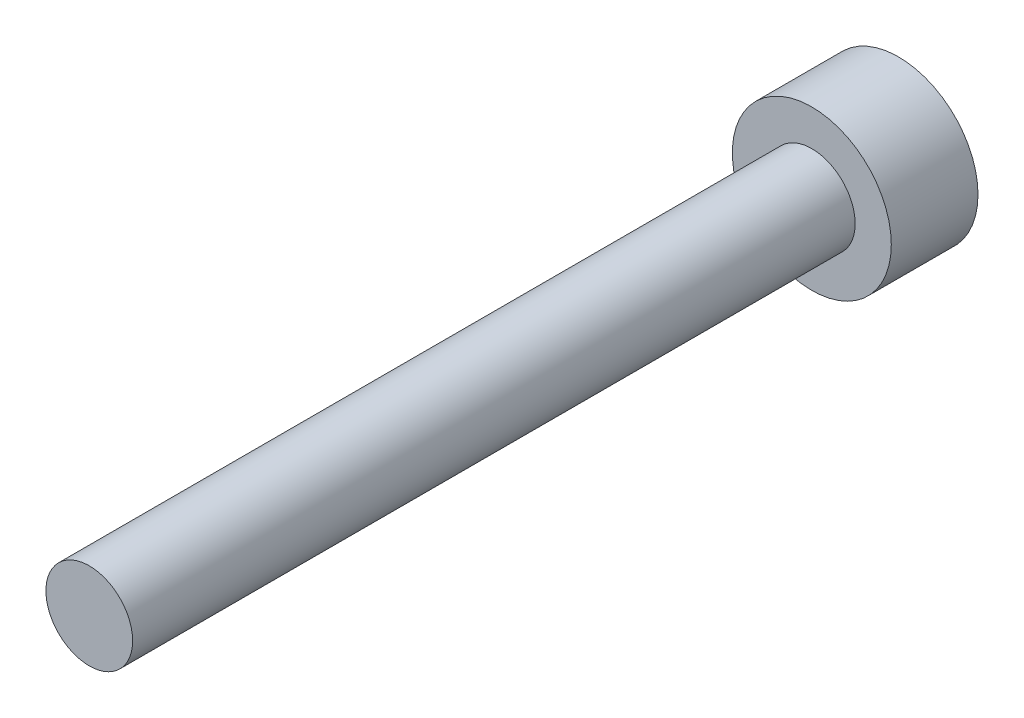
from build123d import *

# Parameters (mm, degrees)
CABEZA_START            = -3
SK_CABEZA_R             = 2.75
CABEZA_DEPTH            = 3
SK_CUERPO_R             = 1.5
CUERPO_DEPTH            = 25
HEXAGONO_INTERIOR_START = -3
HEXAGONO_INTERIOR_DEPTH = 1.5


with BuildPart() as part:
    # Sk_Cabeza → Cabeza (new body)
    with BuildSketch(Plane.XY.offset(CABEZA_START)):
        Circle(SK_CABEZA_R)
    extrude(amount=CABEZA_DEPTH)

    # Sk_Cuerpo → Cuerpo (add)
    with BuildSketch(Plane.XY):
        Circle(SK_CUERPO_R)
    extrude(amount=CUERPO_DEPTH)

    # Sk_Hexagono_interior → Hexagono_interior (cut)
    with BuildSketch(Plane.XY.offset(HEXAGONO_INTERIOR_START)):
        Polygon((0, -1.443375673), (1.25, -0.721687836), (1.25, 0.721687836), (0, 1.443375673), (-1.25, 0.721687836), (-1.25, -0.721687836), align=None)
    extrude(amount=HEXAGONO_INTERIOR_DEPTH, mode=Mode.SUBTRACT)


solid = part.part
